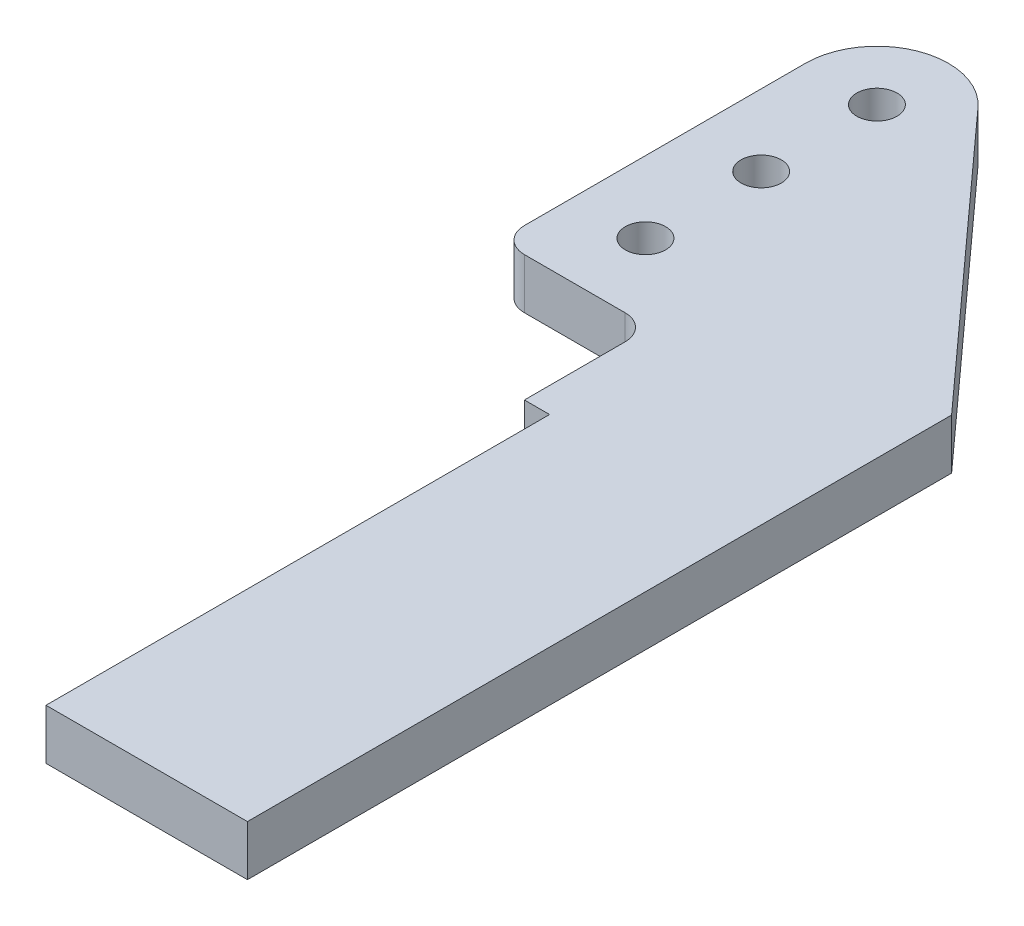
from build123d import *

# Parameters (mm, degrees)
SKETCH1_R           = 0.8
BOSS_EXTRUDE1_DEPTH = 2


with BuildPart() as part:
    # Sketch1 → Boss-Extrude1 (new body)
    with BuildSketch(Plane(origin=(0, 0, 0), x_dir=(1, 0, 0), z_dir=(0, 1, 0))):
        with BuildLine():
            Line((1, 0), (5, 0))
            ThreePointArc((5, 0), (5.707106781, -0.292893219), (6, -1))
            Line((6, -1), (6, -5))
            Line((6, -5), (7, -5))
            Line((7, -5), (7, -25))
            Line((7, -25), (15, -25))
            Line((15, -25), (15, 2.965311532))
            Line((15, 2.965311532), (4.948577491, 14.065616497))
            ThreePointArc((4.948577491, 14.065616497), (1.819757882, 14.809804225), (0, 12.158048434))
            Line((0, 12.158048434), (0, 1))
            ThreePointArc((0, 1), (0.292893219, 0.292893219), (1, 0))
        make_face()
        with Locations(Location((2.841951566, 7.561679983, 0), (0, 0, 270))):
            Circle(SKETCH1_R, mode=Mode.SUBTRACT)
        with Locations(Location((2.841951566, 2.965311532, 0), (0, 0, 270))):
            Circle(SKETCH1_R, mode=Mode.SUBTRACT)
        with Locations(Location((2.841951566, 12.158048434, 0), (0, 0, 270))):
            Circle(SKETCH1_R, mode=Mode.SUBTRACT)
    extrude(amount=BOSS_EXTRUDE1_DEPTH)


solid = part.part
